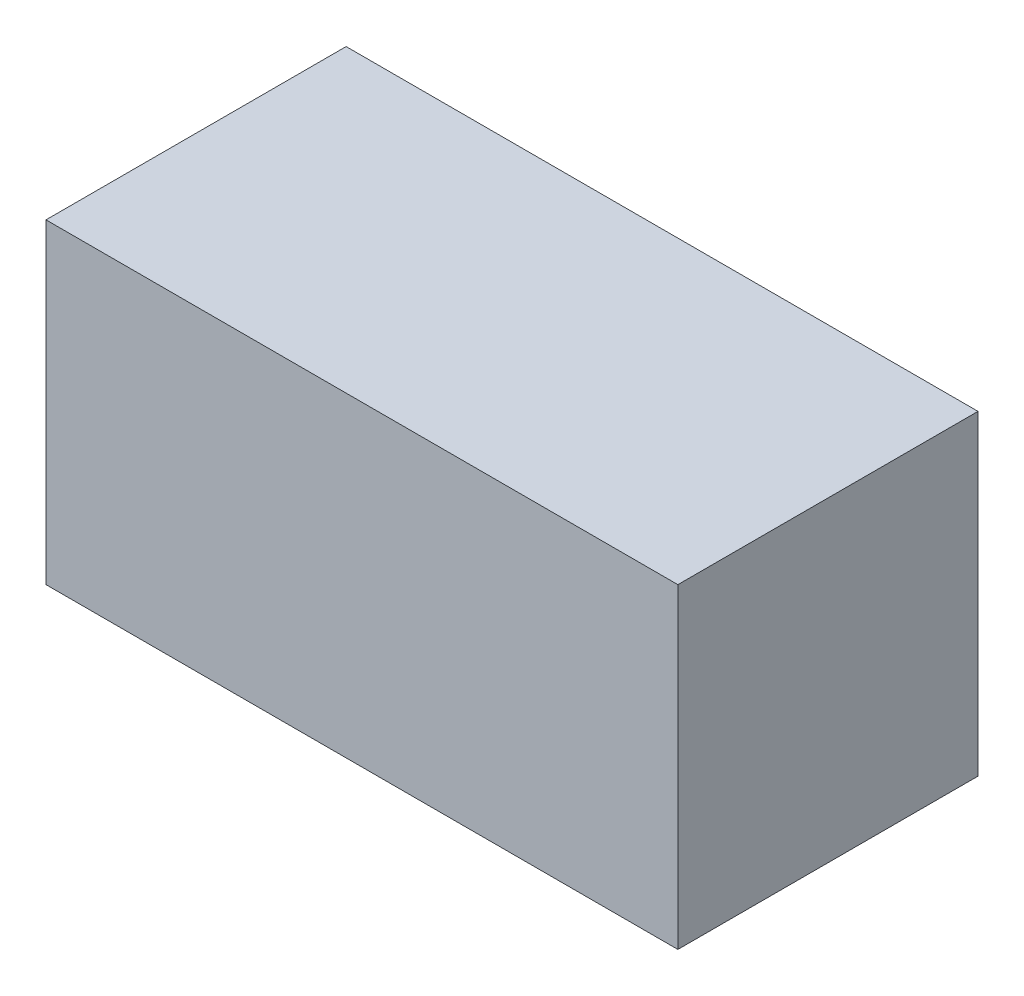
from build123d import *

# Parameters (mm, degrees)
SKETCH1_W           = 40
SKETCH1_H           = 20
BOSS_EXTRUDE1_DEPTH = 19


with BuildPart() as part:
    # Sketch1 → Boss-Extrude1 (new body)
    with BuildSketch(Plane.XY):
        with Locations((20, 10)):
            Rectangle(SKETCH1_W, SKETCH1_H)
    extrude(amount=BOSS_EXTRUDE1_DEPTH)


solid = part.part
